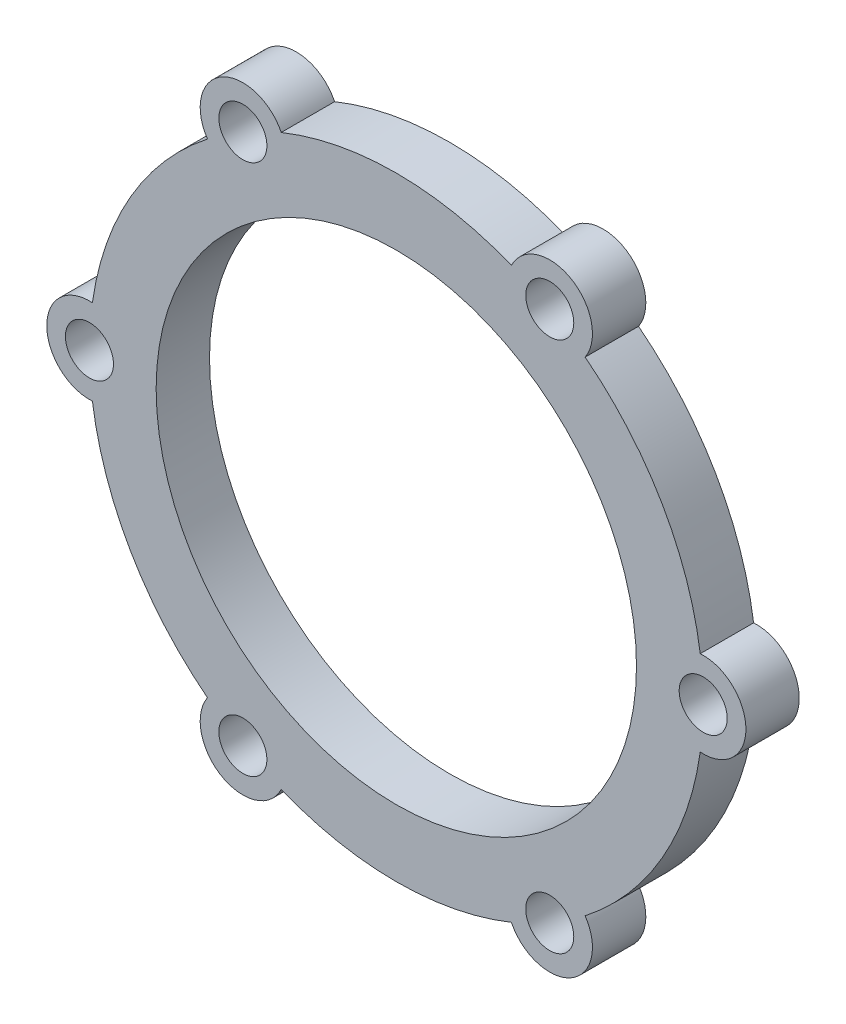
from build123d import *

# Parameters (mm, degrees)
SKETCH1_R           = 4.5
SKETCH1_R_2         = 45
BOSS_EXTRUDE1_DEPTH = 10


with BuildPart() as part:
    # Sketch1 → Boss-Extrude1 (new body)
    with BuildSketch(Plane.XY):
        with BuildLine():
            ThreePointArc((56.943478261, -7.980619246), (65.5, 0), (56.943478261, 7.980619246))
            ThreePointArc((56.943478261, 7.980619246), (49.796460718, 28.75), (35.383158136, 45.324189131))
            ThreePointArc((35.383158136, 45.324189131), (32.75, 56.724663948), (21.560320125, 53.304808377))
            ThreePointArc((21.560320125, 53.304808377), (0, 57.5), (-21.560320125, 53.304808377))
            ThreePointArc((-21.560320125, 53.304808377), (-32.75, 56.724663948), (-35.383158136, 45.324189131))
            ThreePointArc((-35.383158136, 45.324189131), (-49.796460718, 28.75), (-56.943478261, 7.980619246))
            ThreePointArc((-56.943478261, 7.980619246), (-65.5, 0), (-56.943478261, -7.980619246))
            ThreePointArc((-56.943478261, -7.980619246), (-49.796460718, -28.75), (-35.383158136, -45.324189131))
            ThreePointArc((-35.383158136, -45.324189131), (-32.75, -56.724663948), (-21.560320125, -53.304808377))
            ThreePointArc((-21.560320125, -53.304808377), (0, -57.5), (21.560320125, -53.304808377))
            ThreePointArc((21.560320125, -53.304808377), (32.75, -56.724663948), (35.383158136, -45.324189131))
            ThreePointArc((35.383158136, -45.324189131), (49.796460718, -28.75), (56.943478261, -7.980619246))
        make_face()
        with Locations((57.5, 0)):
            Circle(SKETCH1_R, mode=Mode.SUBTRACT)
        with Locations((-57.5, 0)):
            Circle(SKETCH1_R, mode=Mode.SUBTRACT)
        with Locations((-28.75, 49.796460718)):
            Circle(SKETCH1_R, mode=Mode.SUBTRACT)
        with Locations((28.75, 49.796460718)):
            Circle(SKETCH1_R, mode=Mode.SUBTRACT)
        Circle(SKETCH1_R_2, mode=Mode.SUBTRACT)
        with Locations((28.75, -49.796460718)):
            Circle(SKETCH1_R, mode=Mode.SUBTRACT)
        with Locations((-28.75, -49.796460718)):
            Circle(SKETCH1_R, mode=Mode.SUBTRACT)
    extrude(amount=BOSS_EXTRUDE1_DEPTH)


solid = part.part
